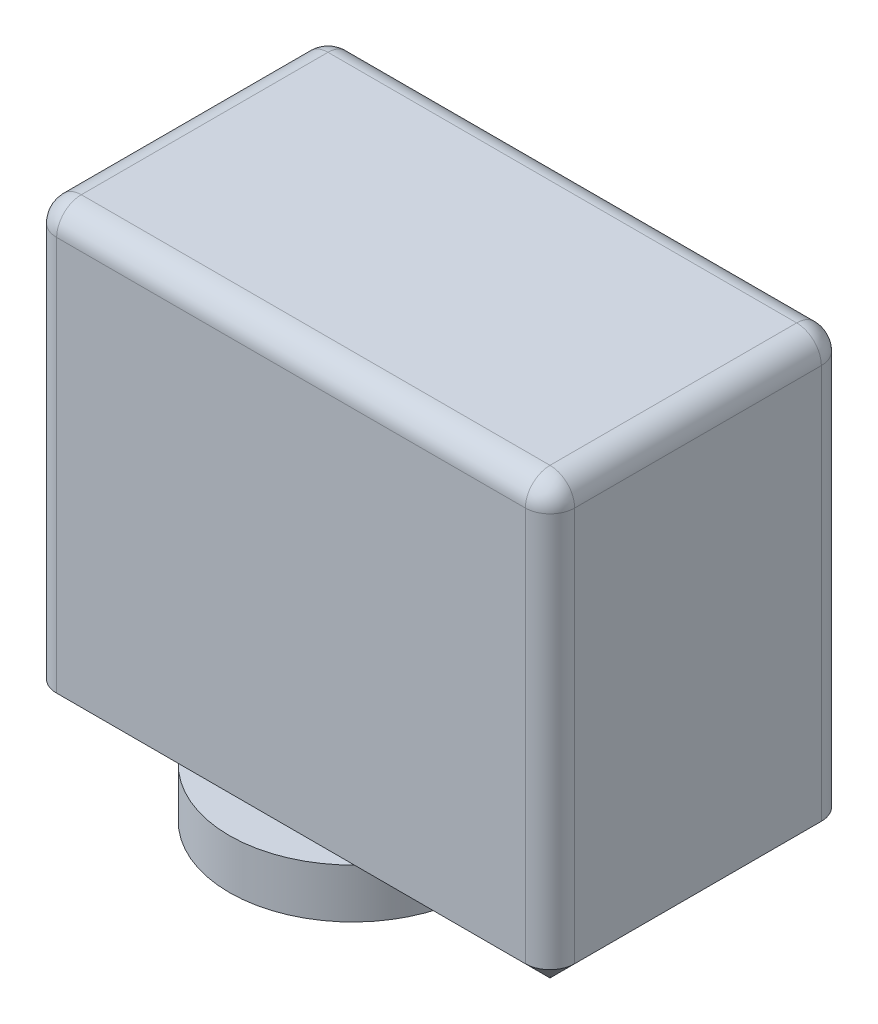
from build123d import *

# Parameters (mm, degrees)
SKETCH_1_R      = 5
EXTRUDE_1_DEPTH = 2
SKETCH_2_R      = 2
EXTRUDE_2_DEPTH = 1.5
EXTRUDE_3_DEPTH = 18
FILLET_1_R      = 1
CHAMFER_1_SIZE  = 1
SCALE_1_SCALE   = 1.703703703


with BuildPart() as part:
    # 草图1 → 凸台-拉伸1 (new body)
    with BuildSketch(Plane(origin=(0, 0, 0), x_dir=(1, 0, 0), z_dir=(0, 1, 0))):
        with Locations(Location((0, 0, 0), (0, 0, 270))):
            Circle(SKETCH_1_R)
    extrude(amount=EXTRUDE_1_DEPTH)

    # 草图2 → 凸台-拉伸2 (add)
    with BuildSketch(Plane(origin=(0, 2, 0), x_dir=(1, 0, 0), z_dir=(0, 1, 0))):
        with Locations(Location((0, 0, 0), (0, 0, 270))):
            Circle(SKETCH_2_R)
    extrude(amount=EXTRUDE_2_DEPTH)

    # 草图3 → 凸台-拉伸3 (add)
    with BuildSketch(Plane(origin=(0, 3.5, 0), x_dir=(1, 0, 0), z_dir=(0, 1, 0))):
        Polygon((0, -6), (-7, -6), (-7, 6), (0, 6), (14, 6), (14, -6), align=None)
    extrude(amount=EXTRUDE_3_DEPTH)

    # 圆角1
    fillet_1_edges = [part.edges().sort_by_distance(p)[0] for p in [
        (14, 12.5, 6),
        (14, 12.5, -6),
        (-7, 12.5, -6),
        (-7, 12.5, 6),
        (3.5, 21.5, 6),
        (14, 21.5, 0),
        (3.5, 21.5, -6),
        (-7, 21.5, 0),
    ]]
    fillet(fillet_1_edges, radius=FILLET_1_R)

    # 倒角1
    chamfer_1_edges = [part.edges().sort_by_distance(p)[0] for p in [
        (-7, 3.5, 0),
        (3.5, 3.5, -6),
        (14, 3.5, 0),
        (3.5, 3.5, 6),
        (-6.707106781, 3.5, -5.707106781),
        (-6.707106781, 3.5, 5.707106781),
        (13.707106781, 3.5, -5.707106781),
        (13.707106781, 3.5, 5.707106781),
    ]]
    chamfer(chamfer_1_edges, length=CHAMFER_1_SIZE)


with BuildPart() as part_1:
    # 缩放比例1: scaled about (3.367633963, 12.104632395, 0)
    add(part.part.scale(SCALE_1_SCALE).moved(Location((-2.36981649, -8.518074639, 0))))


solid = part_1.part
